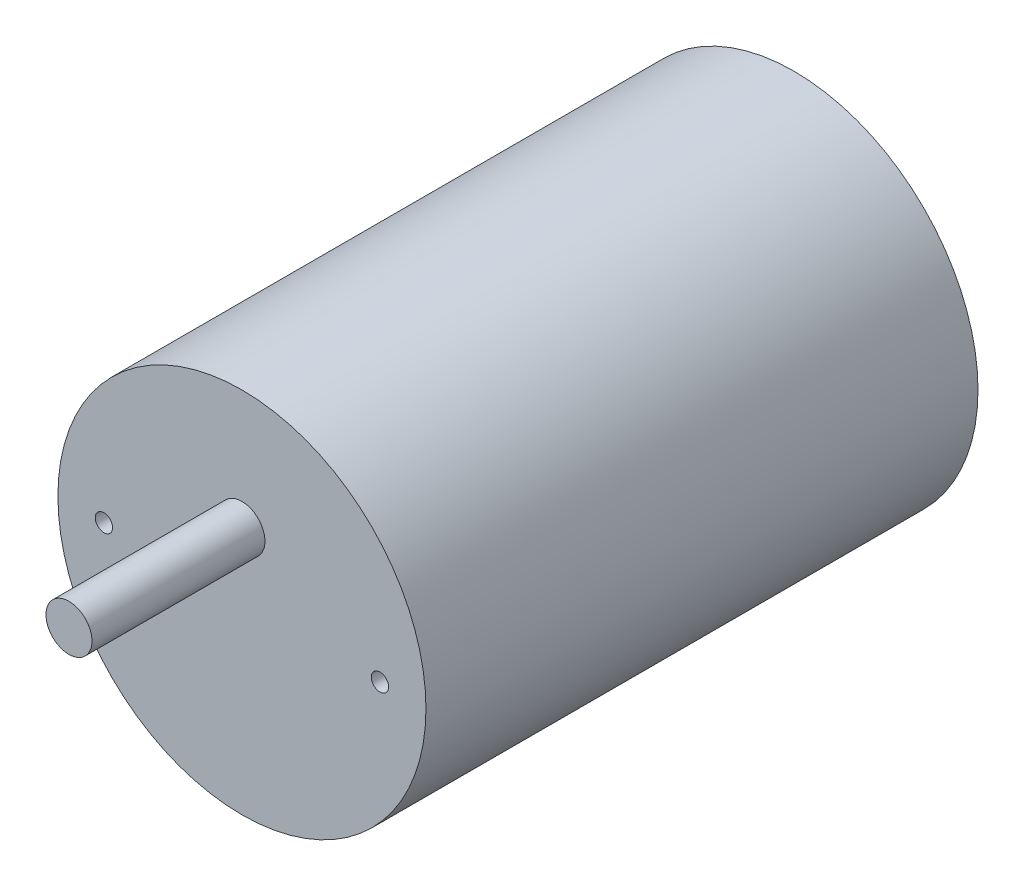
from build123d import *

# Parameters (mm, degrees)
SKETCH1_R           = 25.4
BOSS_EXTRUDE1_DEPTH = 76.2
SKETCH2_R           = 3.175
BOSS_EXTRUDE2_DEPTH = 23.876
SKETCH3_R           = 1.19681919
CUT_EXTRUDE1_DEPTH  = 2.54


with BuildPart() as part:
    # Sketch1 → Boss-Extrude1 (new body)
    with BuildSketch(Plane.XY):
        with Locations(Location((0, 0, 0), (0, 0, 180))):
            Circle(SKETCH1_R)
    extrude(amount=BOSS_EXTRUDE1_DEPTH)

    # Sketch2 → Boss-Extrude2 (add)
    with BuildSketch(Plane.XY.offset(76.2)):
        with Locations((0, 8.89)):
            Circle(SKETCH2_R)
    extrude(amount=BOSS_EXTRUDE2_DEPTH)

    # Sketch3 → Cut-Extrude1 (cut)
    with BuildSketch(Plane.XY.offset(76.2)):
        with Locations((19.05, 0)):
            Circle(SKETCH3_R)
        with Locations(Location((-19.05, 0, 0), (0, 0, 180))):
            Circle(SKETCH3_R)
    extrude(amount=-CUT_EXTRUDE1_DEPTH, mode=Mode.SUBTRACT)


solid = part.part
